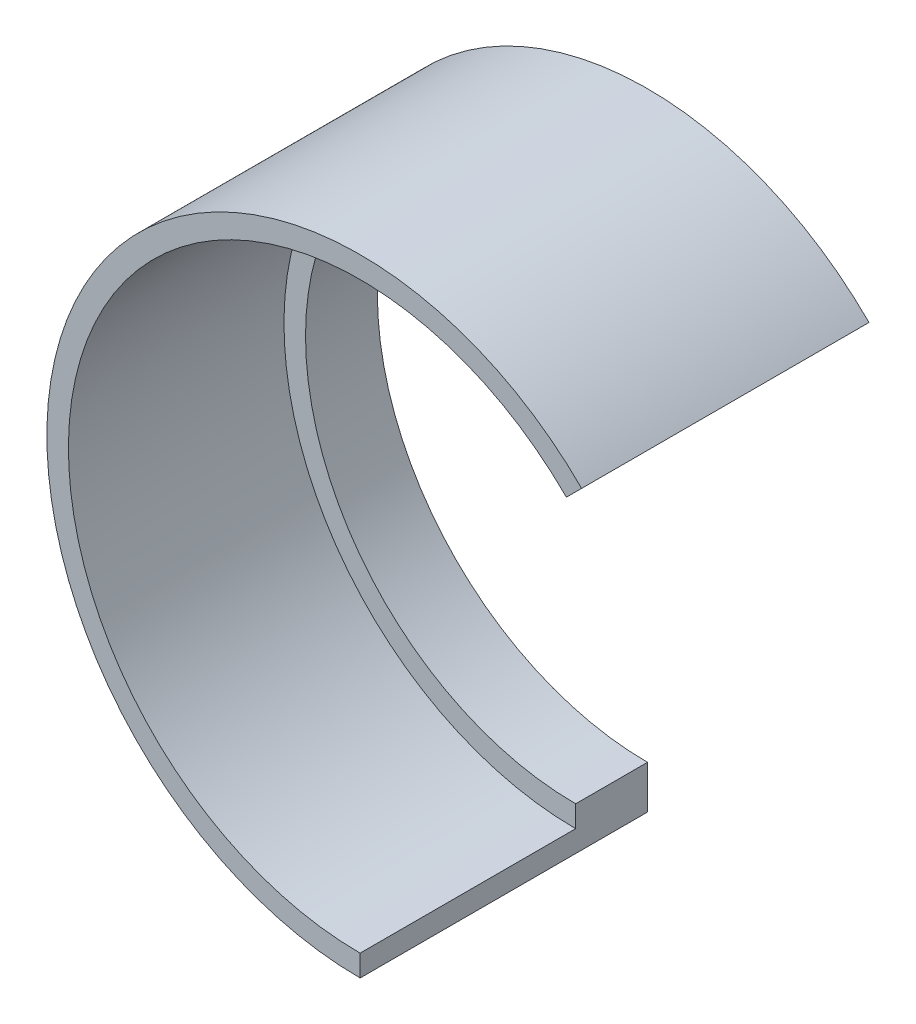
from build123d import *

# Parameters (mm, degrees)
EXTRUDE_1_DEPTH      = 10
EXTRUDE_2_DEPTH      = 30
EXTRUDE_2_DEPTH_BACK = 10


with BuildPart() as part:
    # 草图1 → 凸台-拉伸1 (new body)
    with BuildSketch(Plane.XY):
        with BuildLine():
            Line((0, -40.6), (0, -37.6))
            ThreePointArc((0, -37.6), (-34.737870422, 14.388897057), (26.587214973, 26.587214973))
            Line((26.587214973, 26.587214973), (28.708535316, 28.708535316))
            ThreePointArc((28.708535316, 28.708535316), (-37.50950902, 15.536947354), (0, -40.6))
        make_face()
    extrude(amount=EXTRUDE_1_DEPTH)

    # 草图2 → 凸台-拉伸2 (add, two sides: drawn at the far end of the back side and taken through both)
    with BuildSketch(Plane.XY.offset(10).offset(-EXTRUDE_2_DEPTH_BACK)):
        with BuildLine():
            ThreePointArc((0, -40.6), (-37.50950902, 15.536947354), (28.708535316, 28.708535316))
            Line((28.708535316, 28.708535316), (30.82985566, 30.82985566))
            ThreePointArc((30.82985566, 30.82985566), (-40.281147617, 16.684997651), (0, -43.6))
            Line((0, -43.6), (0, -40.6))
        make_face()
    extrude(amount=EXTRUDE_2_DEPTH + EXTRUDE_2_DEPTH_BACK)


solid = part.part
